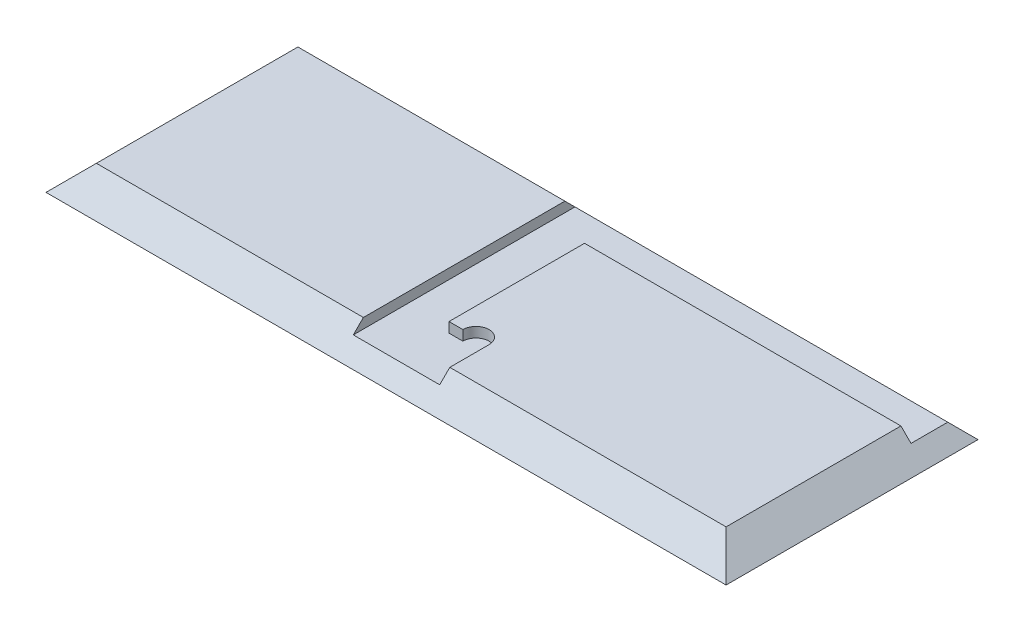
from build123d import *

# Parameters (mm, degrees)
SKETCH1_W           = 342.9
SKETCH1_H           = 127
BOSS_EXTRUDE1_DEPTH = 12.7
DRAFT1_ANGLE        = -45
CUT_EXTRUDE1_DEPTH  = 5.08
SKETCH3_W           = 23.368
SKETCH3_H           = 127
CUT_EXTRUDE2_DEPTH  = 5.08
SKETCH4_W           = 172.212
SKETCH4_H           = 26.162
CUT_EXTRUDE3_DEPTH  = 5.08


with BuildPart() as part:
    # Sketch1 → Boss-Extrude1 (new body)
    with BuildSketch(Plane(origin=(0, 0, 0), x_dir=(1, 0, 0), z_dir=(0, 1, 0))):
        Rectangle(SKETCH1_W, SKETCH1_H)
    extrude(amount=BOSS_EXTRUDE1_DEPTH)

    # Draft1
    draft1_faces = [part.faces().sort_by_distance(p)[0] for p in [
        (0, 6.35, -63.5),
        (-171.45, 6.35, 0),
        (171.45, 6.35, 0),
        (0, 6.35, 63.5),
    ]]
    draft(draft1_faces, Plane(origin=(0, 0, 0), x_dir=(0, 0, -1), z_dir=(0, -1, 0)), DRAFT1_ANGLE)

    # Sketch2 → Cut-Extrude1 (cut)
    with BuildSketch(Plane(origin=(0, 12.7, 0), x_dir=(1, 0, 0), z_dir=(0, 1, 0))):
        with BuildLine():
            Line((-19.431, -63.5), (19.431, -63.5))
            Line((19.431, -63.5), (19.431, -30.988))
            ThreePointArc((19.431, -30.988), (12.827, -24.384), (6.223, -30.988))
            Line((6.223, -30.988), (-6.223, -30.988))
            ThreePointArc((-6.223, -30.988), (-12.827, -24.384), (-19.431, -30.988))
            Line((-19.431, -30.988), (-19.431, -63.5))
        make_face()
    extrude(amount=-CUT_EXTRUDE1_DEPTH, mode=Mode.SUBTRACT)

    # Sketch3 → Cut-Extrude2 (cut)
    with BuildSketch(Plane(origin=(0, 12.7, 0), x_dir=(1, 0, 0), z_dir=(0, 1, 0))):
        with Locations((-12.446, 0)):
            Rectangle(SKETCH3_W, SKETCH3_H)
    extrude(amount=-CUT_EXTRUDE2_DEPTH, mode=Mode.SUBTRACT)

    # Sketch4 → Cut-Extrude3 (cut)
    with BuildSketch(Plane(origin=(0, 12.7, 0), x_dir=(1, 0, 0), z_dir=(0, 1, 0))):
        with Locations((85.344, 50.419)):
            Rectangle(SKETCH4_W, SKETCH4_H)
    extrude(amount=-CUT_EXTRUDE3_DEPTH, mode=Mode.SUBTRACT)


solid = part.part
